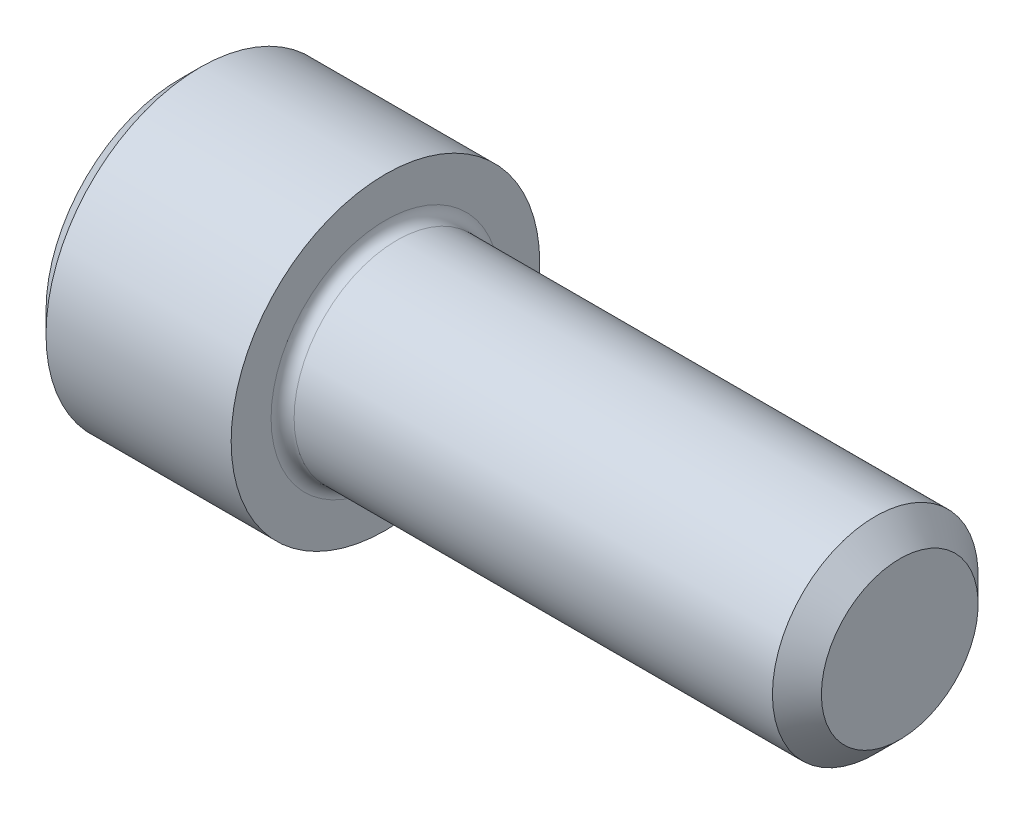
from build123d import *

# Parameters (mm, degrees)
FILLET1_R   = 0.3556
HEX_2_DEPTH = 3.048


with BuildPart() as part:
    # BodySke → Base-Revolve (revolve)
    with BuildSketch(Plane.XY, mode=Mode.PRIVATE) as base_revolve_sk:
        Polygon((0, 0), (0, 4.1275), (0.635, 4.7625), (6.35, 4.7625), (6.35, 3.175), (21.46935, 3.175), (22.225, 2.41935), (22.225, 0), align=None)
    revolve(base_revolve_sk.sketch.rotate(Axis((-31.75, 0, 0), (1, 0, 0)), 90), axis=Axis((-31.75, 0, 0), (1, 0, 0)))

    # Fillet1
    fillet1_edges = [part.edges().sort_by_distance(p)[0] for p in [
        (6.35, 0, -3.175),
    ]]
    fillet(fillet1_edges, radius=FILLET1_R)

    # Sketch2 → Hex-PreBroach (revolve, cut)
    with BuildSketch(Plane.XY, mode=Mode.PRIVATE) as hex_prebroach_sk:
        Polygon((0, 2.38125), (3.048, 2.38125), (4.422815329, 0), (0, 0), align=None)
    revolve(hex_prebroach_sk.sketch.rotate(Axis((0, 0, 0), (1, 0, 0)), 90), axis=Axis((0, 0, 0), (1, 0, 0)), mode=Mode.SUBTRACT)

    # Sketch3 → Hex 2 (cut)
    with BuildSketch(Plane(origin=(0, 0, 0), x_dir=(0, 0.500000000000001, 0.866025403784438), z_dir=(-1, 0, 0))):
        Polygon((1.374815329, 2.38125), (-1.374815329, 2.38125), (-2.749630657, 0), (-1.374815329, -2.38125), (1.374815329, -2.38125), (2.749630657, 0), align=None)
    extrude(amount=-HEX_2_DEPTH, mode=Mode.SUBTRACT)


solid = part.part
